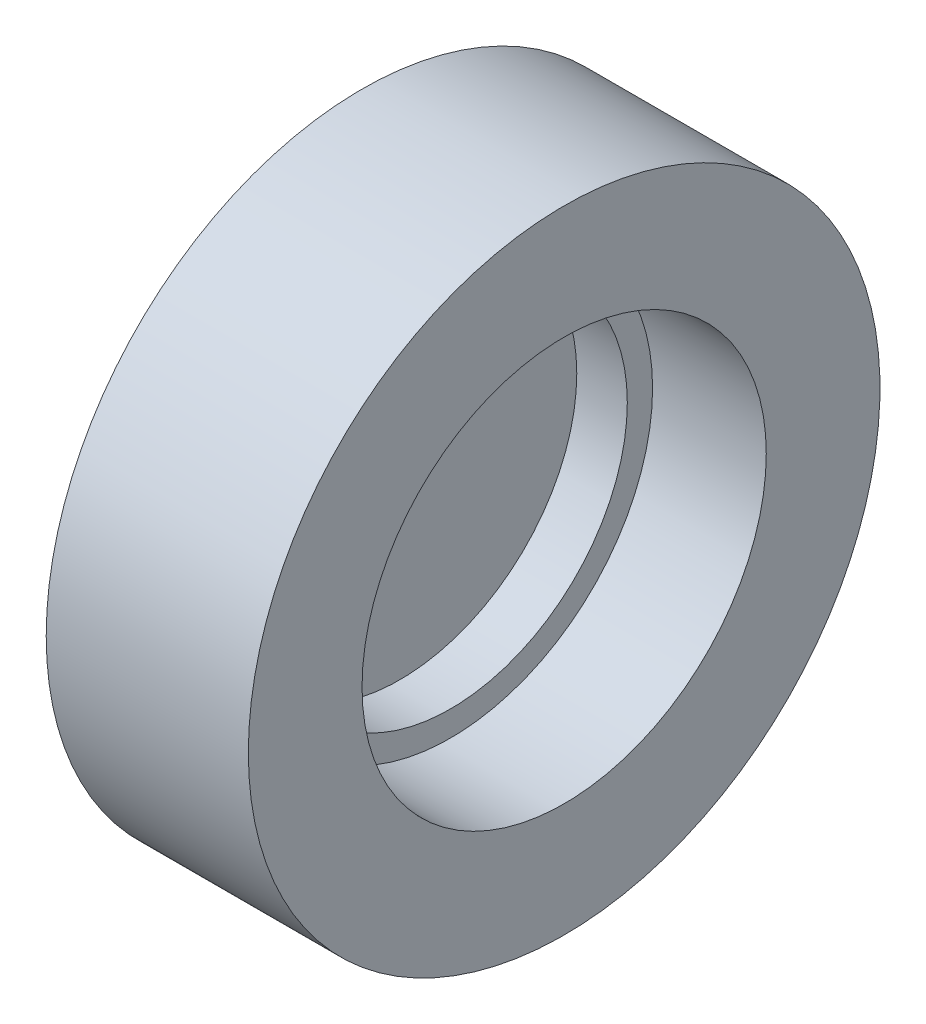
from build123d import *


with BuildPart() as part:
    # Esboço1 → Revolução1 (revolve)
    with BuildSketch(Plane.XY, mode=Mode.PRIVATE) as revolu_o1_sk:
        Polygon((0, 0), (0, 25), (16, 25), (16, 16), (7, 16), (7, 14), (3, 14), (3, 0), align=None)
    revolve(revolu_o1_sk.sketch.rotate(Axis((0, 0, 0), (1, 0, 0)), 90), axis=Axis((0, 0, 0), (1, 0, 0)))


solid = part.part
